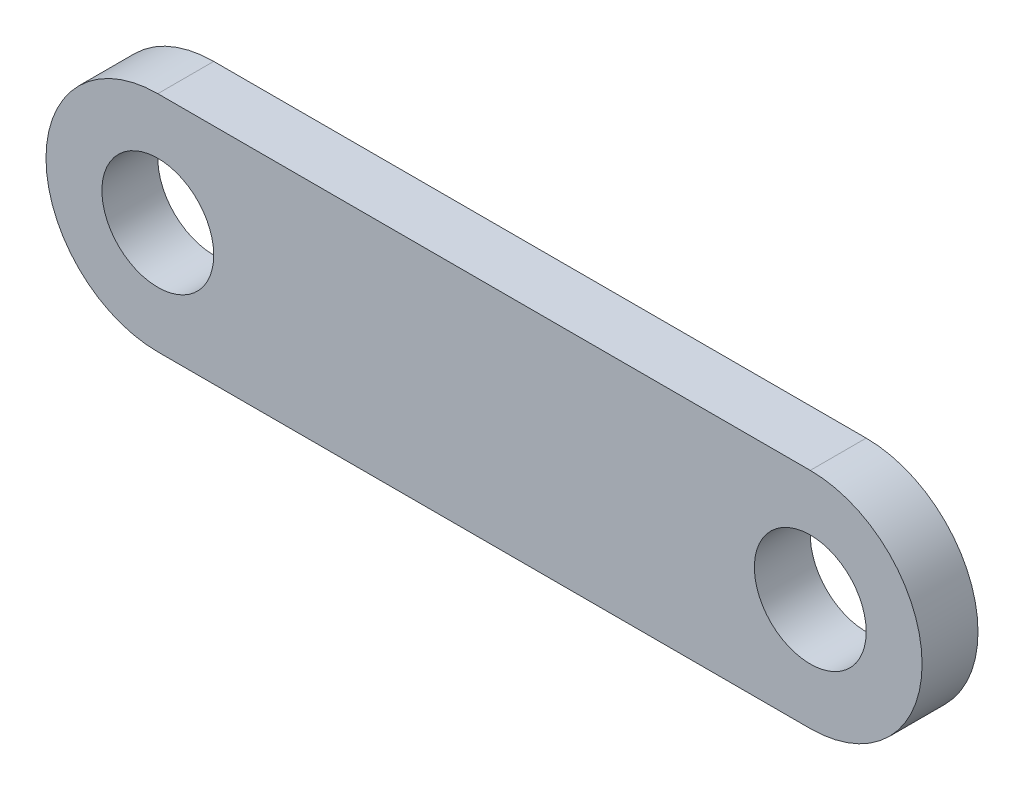
from build123d import *

# Parameters (mm, degrees)
ESBO_O1_R                = 1
RESSALTO_EXTRUS_O1_DEPTH = 1


with BuildPart() as part:
    # Esboço1 → Ressalto-extrusão1 (new body)
    with BuildSketch(Plane.XY):
        with BuildLine():
            Line((-5.835, 2), (5.835, 2))
            ThreePointArc((5.835, 2), (7.835, 0), (5.835, -2))
            Line((5.835, -2), (-5.835, -2))
            ThreePointArc((-5.835, -2), (-7.835, 0), (-5.835, 2))
        make_face()
        with Locations((-5.835, 0)):
            Circle(ESBO_O1_R, mode=Mode.SUBTRACT)
        with Locations((5.835, 0)):
            Circle(ESBO_O1_R, mode=Mode.SUBTRACT)
    extrude(amount=RESSALTO_EXTRUS_O1_DEPTH)


solid = part.part
